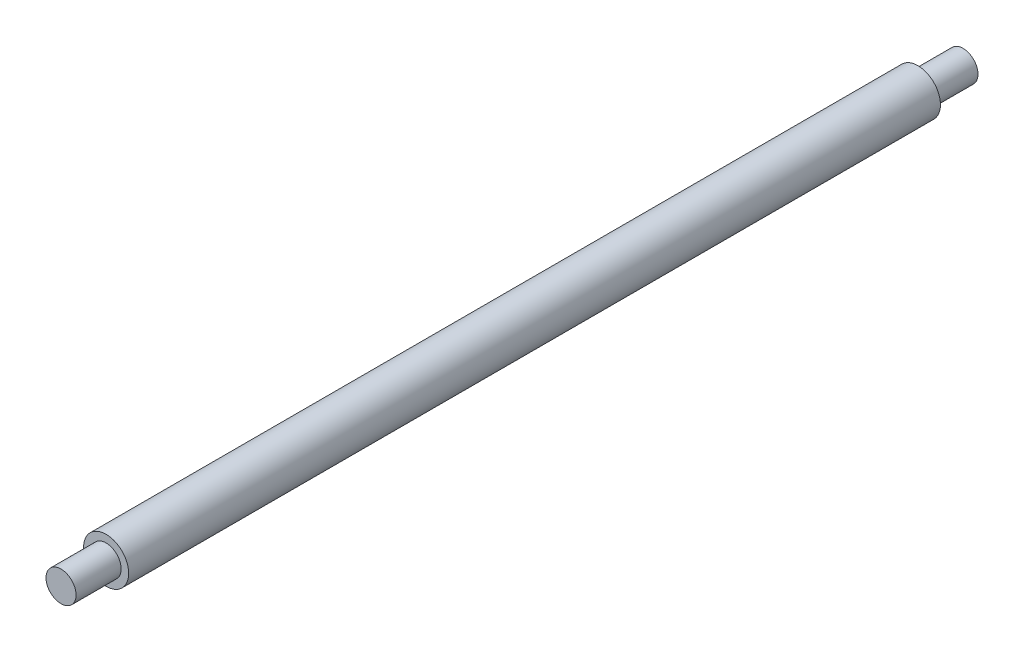
from build123d import *

# Parameters (mm, degrees)
SKETCH1_R           = 9.525
BOSS_EXTRUDE1_DEPTH = 342.9
SKETCH3_R           = 6.35
BOSS_EXTRUDE2_DEPTH = 19.05
BOSS_EXTRUDE3_START = 19.05
SKETCH4_R           = 6.35
BOSS_EXTRUDE3_DEPTH = 19.05


with BuildPart() as part:
    # Sketch1 → Boss-Extrude1 (new body)
    with BuildSketch(Plane.XY):
        Circle(SKETCH1_R)
    extrude(amount=BOSS_EXTRUDE1_DEPTH)

    # Sketch3 → Boss-Extrude2 (add)
    with BuildSketch(Plane.XY.offset(342.9)):
        with Locations(Location((0, 0, 0), (0, 0, 180))):
            Circle(SKETCH3_R)
    extrude(amount=BOSS_EXTRUDE2_DEPTH)

    # Sketch4 → Boss-Extrude3 (add)
    with BuildSketch(Plane(origin=(0, 0, 0), x_dir=(-1, 0, 0), z_dir=(0, 0, -1)).offset(BOSS_EXTRUDE3_START)):
        Circle(SKETCH4_R)
    extrude(amount=-BOSS_EXTRUDE3_DEPTH)


solid = part.part
